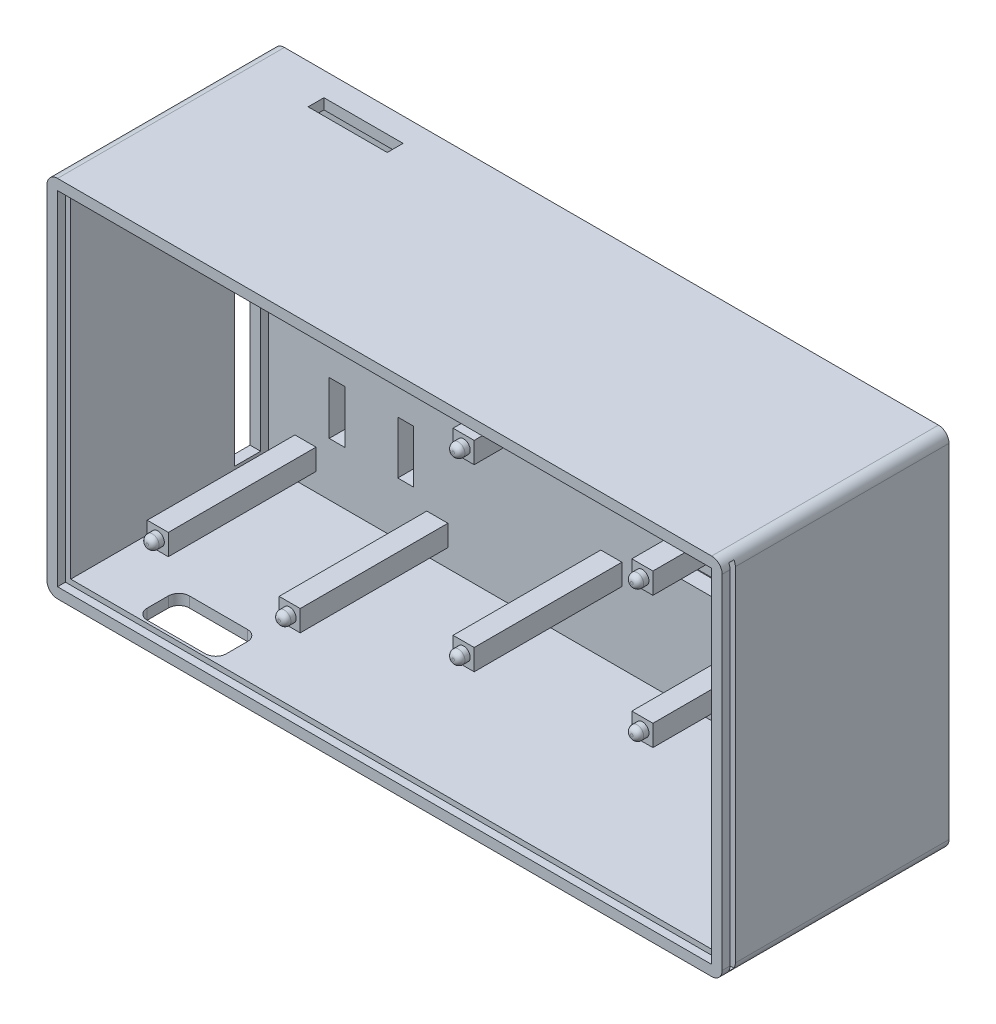
from build123d import *

# Parameters (mm, degrees)
SALIENTE_EXTRUIR1_DEPTH           = 3
CROQUIS2_W                        = 124
CROQUIS2_H                        = 65.043293936
SALIENTE_EXTRUIR2_DEPTH           = 43
CORTAR_EXTRUIR1_REACH             = 86.479
CROQUIS3_W                        = 1
CROQUIS3_H                        = 67.043293936
CORTAR_EXTRUIR1_DIRECTION_2_DEPTH = 63
CROQUIS4_W                        = 4
CROQUIS4_H                        = 4
CROQUIS4_R                        = 1.25
SALIENTE_EXTRUIR3_DEPTH           = 31
CROQUIS6_R                        = 1.25
SALIENTE_EXTRUIR4_DEPTH           = 33
REDONDEO3_R                       = 1
CORTAR_EXTRUIR2_REACH             = 105.499
CORTAR_EXTRUIR3_REACH             = 141.373
CROQUIS10_W                       = 5
CROQUIS10_H                       = 59.043293936
CORTAR_EXTRUIR4_REACH             = 86.479
CROQUIS11_W                       = 3
CROQUIS11_H                       = 10
CROQUIS11_W_2                     = 14.157650518
CROQUIS11_H_2                     = 3
CROQUIS11_H_3                     = 3.14614456
CORTAR_EXTRUIR5_REACH             = 105.499
CROQUIS13_W                       = 15
CROQUIS13_H                       = 3


with BuildPart() as part:
    # Croquis1 → Saliente-Extruir1 (new body)
    with BuildSketch(Plane.XY):
        with BuildLine():
            Line((62, -34.5), (-62, -34.5))
            ThreePointArc((-62, -34.5), (-63.414213562, -33.914213562), (-64, -32.5))
            Line((-64, -32.5), (-64, 32.5))
            ThreePointArc((-64, 32.5), (-63.414213562, 33.914213562), (-62, 34.5))
            Line((-62, 34.5), (62, 34.5))
            ThreePointArc((62, 34.5), (63.414213562, 33.914213562), (64, 32.5))
            Line((64, 32.5), (64, -32.5))
            ThreePointArc((64, -32.5), (63.414213562, -33.914213562), (62, -34.5))
        make_face()
    extrude(amount=SALIENTE_EXTRUIR1_DEPTH)

    # Croquis2 → Saliente-Extruir2 (add)
    with BuildSketch(Plane.XY):
        with BuildLine():
            Line((62, -34.521646968), (-62, -34.521646968))
            ThreePointArc((-62, -34.521646968), (-63.414213562, -33.93586053), (-64, -32.521646968))
            Line((-64, -32.521646968), (-64, 32.521646968))
            ThreePointArc((-64, 32.521646968), (-63.414213562, 33.93586053), (-62, 34.521646968))
            Line((-62, 34.521646968), (62, 34.521646968))
            ThreePointArc((62, 34.521646968), (63.414213562, 33.93586053), (64, 32.521646968))
            Line((64, 32.521646968), (64, -32.521646968))
            ThreePointArc((64, -32.521646968), (63.414213562, -33.93586053), (62, -34.521646968))
        make_face()
        Rectangle(CROQUIS2_W, CROQUIS2_H, mode=Mode.SUBTRACT)
    extrude(amount=SALIENTE_EXTRUIR2_DEPTH)

    # Croquis3 → Cortar-Extruir1 (cut, up to next)
    with BuildSketch(Plane(origin=(0, 0, 0), x_dir=(0, 0, -1), z_dir=(1, 0, 0)), mode=Mode.PRIVATE) as cortar_extruir1_sk1:
        with Locations((-41, 0)):
            Rectangle(CROQUIS3_W, CROQUIS3_H)
    cortar_extruir1_tool1 = extrude(cortar_extruir1_sk1.sketch, amount=CORTAR_EXTRUIR1_REACH, mode=Mode.PRIVATE) & part.part
    add(cortar_extruir1_tool1.solids().sort_by_distance((0, 0, 41))[0], mode=Mode.SUBTRACT)

    # Croquis3 → Cortar-Extruir1 direction 2 (cut)
    with BuildSketch(Plane(origin=(0, 0, 0), x_dir=(0, 0, -1), z_dir=(1, 0, 0))):
        with Locations((-41, 0)):
            Rectangle(CROQUIS3_W, CROQUIS3_H)
    extrude(amount=-CORTAR_EXTRUIR1_DIRECTION_2_DEPTH, mode=Mode.SUBTRACT)

    # Croquis4 → Saliente-Extruir3 (add)
    # profile 1 of 8: a face of its own
    with BuildSketch(Plane.XY):
        with Locations((-55, 24.9029505)):
            Rectangle(CROQUIS4_W, CROQUIS4_H)
        with Locations(Location((-55, 24.9029505, 0), (0, 0, 180))):
            Circle(CROQUIS4_R, mode=Mode.SUBTRACT)
    # profile 2 of 8: a face of its own
    with BuildSketch(Plane.XY):
        with Locations((-30, 24.9029505)):
            Rectangle(CROQUIS4_W, CROQUIS4_H)
        with Locations(Location((-30, 24.9029505, 0), (0, 0, 180))):
            Circle(CROQUIS4_R, mode=Mode.SUBTRACT)
    # profile 3 of 8: a face of its own
    with BuildSketch(Plane.XY):
        with Locations((-55, -27.0970495)):
            Rectangle(CROQUIS4_W, CROQUIS4_H)
        with Locations(Location((-55, -27.0970495, 0), (0, 0, 180))):
            Circle(CROQUIS4_R, mode=Mode.SUBTRACT)
    # profile 4 of 8: a face of its own
    with BuildSketch(Plane.XY):
        with Locations((-30, -27.0970495)):
            Rectangle(CROQUIS4_W, CROQUIS4_H)
        with Locations(Location((-30, -27.0970495, 0), (0, 0, 180))):
            Circle(CROQUIS4_R, mode=Mode.SUBTRACT)
    # profile 5 of 8: a face of its own
    with BuildSketch(Plane.XY):
        with Locations((2.98327452, 17)):
            Rectangle(CROQUIS4_W, CROQUIS4_H)
        with Locations(Location((2.98327452, 17, 0), (0, 0, 180))):
            Circle(CROQUIS4_R, mode=Mode.SUBTRACT)
    # profile 6 of 8: a face of its own
    with BuildSketch(Plane.XY):
        with Locations((2.98327452, -17)):
            Rectangle(CROQUIS4_W, CROQUIS4_H)
        with Locations(Location((2.98327452, -17, 0), (0, 0, 180))):
            Circle(CROQUIS4_R, mode=Mode.SUBTRACT)
    # profile 7 of 8: a face of its own
    with BuildSketch(Plane.XY):
        with Locations((36.870971788, -12.5)):
            Rectangle(CROQUIS4_W, CROQUIS4_H)
        with Locations(Location((36.870971788, -12.5, 0), (0, 0, 180))):
            Circle(CROQUIS4_R, mode=Mode.SUBTRACT)
    # profile 8 of 8: a face of its own
    with BuildSketch(Plane.XY):
        with Locations((36.870971788, 12.5)):
            Rectangle(CROQUIS4_W, CROQUIS4_H)
        with Locations(Location((36.870971788, 12.5, 0), (0, 0, 180))):
            Circle(CROQUIS4_R, mode=Mode.SUBTRACT)
    extrude(amount=SALIENTE_EXTRUIR3_DEPTH)

    # Croquis6 → Saliente-Extruir4 (add)
    with BuildSketch(Plane.XY):
        with Locations((-55, 24.9029505)):
            Circle(CROQUIS6_R)
        with Locations((-30, 24.9029505)):
            Circle(CROQUIS6_R)
        with Locations((-30, -27.0970495)):
            Circle(CROQUIS6_R)
        with Locations((-55, -27.0970495)):
            Circle(CROQUIS6_R)
        with Locations((2.98327452, -17)):
            Circle(CROQUIS6_R)
        with Locations((36.870971788, -12.5)):
            Circle(CROQUIS6_R)
        with Locations((36.870971788, 12.5)):
            Circle(CROQUIS6_R)
        with Locations((2.98327452, 17)):
            Circle(CROQUIS6_R)
    extrude(amount=SALIENTE_EXTRUIR4_DEPTH)

    # Redondeo3
    redondeo3_edges = [part.edges().sort_by_distance(p)[0] for p in [
        (-56.25, 24.9029505, 33),
        (-31.25, 24.9029505, 33),
        (-31.25, -27.0970495, 33),
        (-56.25, -27.0970495, 33),
        (1.73327452, -17, 33),
        (35.620971788, -12.5, 33),
        (35.620971788, 12.5, 33),
        (1.73327452, 17, 33),
    ]]
    fillet(redondeo3_edges, radius=REDONDEO3_R)

    # Croquis9 → Cortar-Extruir2 (cut, up to next)
    with BuildSketch(Plane.XZ.offset(34.521646968), mode=Mode.PRIVATE) as cortar_extruir2_sk1:
        with BuildLine():
            Line((-48, 40), (-37, 40))
            ThreePointArc((-37, 40), (-35.585786438, 39.414213562), (-35, 38))
            Line((-35, 38), (-35, 34))
            ThreePointArc((-35, 34), (-35.585786438, 32.585786438), (-37, 32))
            Line((-37, 32), (-48, 32))
            ThreePointArc((-48, 32), (-49.414213562, 32.585786438), (-50, 34))
            Line((-50, 34), (-50, 38))
            ThreePointArc((-50, 38), (-49.414213562, 39.414213562), (-48, 40))
        make_face()
    cortar_extruir2_tool1 = extrude(cortar_extruir2_sk1.sketch, amount=-CORTAR_EXTRUIR2_REACH, mode=Mode.PRIVATE) & part.part
    add(cortar_extruir2_tool1.solids().sort_by_distance((-42.5, -34.521647, 36))[0], mode=Mode.SUBTRACT)

    # Croquis10 → Cortar-Extruir3 (cut, up to next)
    with BuildSketch(Plane.ZY.offset(64), mode=Mode.PRIVATE) as cortar_extruir3_sk1:
        with Locations((7, 0)):
            Rectangle(CROQUIS10_W, CROQUIS10_H)
    cortar_extruir3_tool1 = extrude(cortar_extruir3_sk1.sketch, amount=-CORTAR_EXTRUIR3_REACH, mode=Mode.PRIVATE) & part.part
    add(cortar_extruir3_tool1.solids().sort_by_distance((-64, 0, 7))[0], mode=Mode.SUBTRACT)

    # Croquis11 → Cortar-Extruir4 (cut, up to next)
    with BuildSketch(Plane.XY, mode=Mode.PRIVATE) as cortar_extruir4_sk1:
        with Locations((-49, 15.223092442)):
            Rectangle(CROQUIS11_W, CROQUIS11_H)
    cortar_extruir4_tool1 = extrude(cortar_extruir4_sk1.sketch, amount=CORTAR_EXTRUIR4_REACH, mode=Mode.PRIVATE) & part.part
    # Croquis11 → Cortar-Extruir4 (cut, up to next)
    with BuildSketch(Plane.XY, mode=Mode.PRIVATE) as cortar_extruir4_sk2:
        with Locations((-36, 15.223092442)):
            Rectangle(CROQUIS11_W, CROQUIS11_H)
    cortar_extruir4_tool2 = extrude(cortar_extruir4_sk2.sketch, amount=CORTAR_EXTRUIR4_REACH, mode=Mode.PRIVATE) & part.part
    # Croquis11 → Cortar-Extruir4 (cut, up to next)
    with BuildSketch(Plane.XY, mode=Mode.PRIVATE) as cortar_extruir4_sk3:
        with Locations((-49, -17.417191442)):
            Rectangle(CROQUIS11_W, CROQUIS11_H)
    cortar_extruir4_tool3 = extrude(cortar_extruir4_sk3.sketch, amount=CORTAR_EXTRUIR4_REACH, mode=Mode.PRIVATE) & part.part
    # Croquis11 → Cortar-Extruir4 (cut, up to next)
    with BuildSketch(Plane.XY, mode=Mode.PRIVATE) as cortar_extruir4_sk4:
        with Locations((-36, -17.417191442)):
            Rectangle(CROQUIS11_W, CROQUIS11_H)
    cortar_extruir4_tool4 = extrude(cortar_extruir4_sk4.sketch, amount=CORTAR_EXTRUIR4_REACH, mode=Mode.PRIVATE) & part.part
    # Croquis11 → Cortar-Extruir4 (cut, up to next)
    with BuildSketch(Plane.XY, mode=Mode.PRIVATE) as cortar_extruir4_sk5:
        with Locations((19.942653438, 10.5)):
            Rectangle(CROQUIS11_W_2, CROQUIS11_H_2)
    cortar_extruir4_tool5 = extrude(cortar_extruir4_sk5.sketch, amount=CORTAR_EXTRUIR4_REACH, mode=Mode.PRIVATE) & part.part
    # Croquis11 → Cortar-Extruir4 (cut, up to next)
    with BuildSketch(Plane.XY, mode=Mode.PRIVATE) as cortar_extruir4_sk6:
        with Locations((19.942653438, -10.57307228)):
            Rectangle(CROQUIS11_W_2, CROQUIS11_H_3)
    cortar_extruir4_tool6 = extrude(cortar_extruir4_sk6.sketch, amount=CORTAR_EXTRUIR4_REACH, mode=Mode.PRIVATE) & part.part
    add(cortar_extruir4_tool1.solids().sort_by_distance((-49, 15.223092, 0))[0], mode=Mode.SUBTRACT)
    add(cortar_extruir4_tool2.solids().sort_by_distance((-36, 15.223092, 0))[0], mode=Mode.SUBTRACT)
    add(cortar_extruir4_tool3.solids().sort_by_distance((-49, -17.417191, 0))[0], mode=Mode.SUBTRACT)
    add(cortar_extruir4_tool4.solids().sort_by_distance((-36, -17.417191, 0))[0], mode=Mode.SUBTRACT)
    add(cortar_extruir4_tool5.solids().sort_by_distance((19.942653, 10.5, 0))[0], mode=Mode.SUBTRACT)
    add(cortar_extruir4_tool6.solids().sort_by_distance((19.942653, -10.573072, 0))[0], mode=Mode.SUBTRACT)

    # Croquis13 → Cortar-Extruir5 (cut, up to next)
    with BuildSketch(Plane(origin=(0, 34.521646968, 0), x_dir=(1, 0, 0), z_dir=(0, 1, 0)), mode=Mode.PRIVATE) as cortar_extruir5_sk1:
        with Locations((-42.5, -6)):
            Rectangle(CROQUIS13_W, CROQUIS13_H)
    cortar_extruir5_tool1 = extrude(cortar_extruir5_sk1.sketch, amount=-CORTAR_EXTRUIR5_REACH, mode=Mode.PRIVATE) & part.part
    add(cortar_extruir5_tool1.solids().sort_by_distance((-42.5, 34.521647, 6))[0], mode=Mode.SUBTRACT)


solid = part.part
